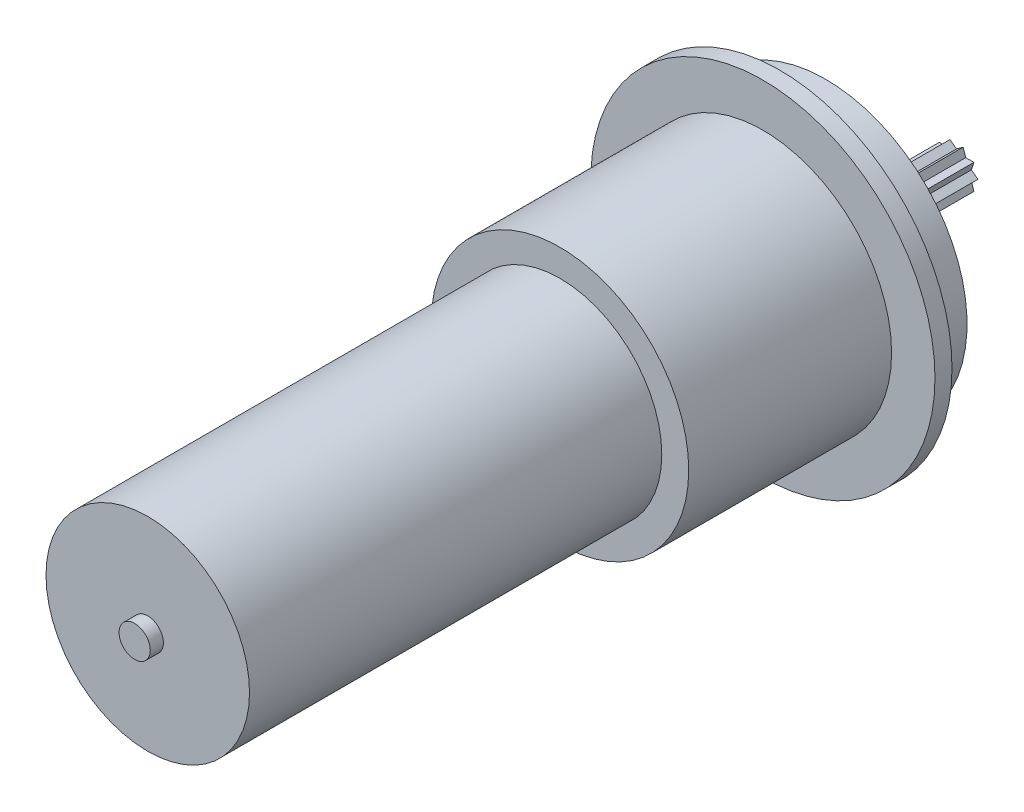
from build123d import *

# Parameters (mm, degrees)
SKETCH1_R           = 49.9618
BOSS_EXTRUDE1_DEPTH = 78.74
SKETCH2_R           = 66.802
BOSS_EXTRUDE2_DEPTH = 6.604
SKETCH3_R           = 54.864
BOSS_EXTRUDE3_DEPTH = 17.78
SKETCH4_R           = 11.878006526
BOSS_EXTRUDE4_DEPTH = 12.7
BOSS_EXTRUDE5_DEPTH = 38.1
SKETCH7_R           = 39.497
BOSS_EXTRUDE6_DEPTH = 160.02
SKETCH8_R           = 6.058651835
BOSS_EXTRUDE7_DEPTH = 5.08


with BuildPart() as part:
    # Sketch1 → Boss-Extrude1 (new body)
    with BuildSketch(Plane.XY):
        Circle(SKETCH1_R)
    extrude(amount=BOSS_EXTRUDE1_DEPTH)

    # Sketch2 → Boss-Extrude2 (add)
    with BuildSketch(Plane(origin=(0, 0, 0), x_dir=(-1, 0, 0), z_dir=(0, 0, -1))):
        with Locations(Location((0, 0, 0), (0, 0, 180))):
            Circle(SKETCH2_R)
    extrude(amount=BOSS_EXTRUDE2_DEPTH)

    # Sketch3 → Boss-Extrude3 (add)
    with BuildSketch(Plane(origin=(0, 0, -6.604), x_dir=(-1, 0, 0), z_dir=(0, 0, -1))):
        Circle(SKETCH3_R)
    extrude(amount=BOSS_EXTRUDE3_DEPTH)

    # Sketch4 → Boss-Extrude4 (add)
    with BuildSketch(Plane(origin=(0, 0, -24.384), x_dir=(-1, 0, 0), z_dir=(0, 0, -1))):
        Circle(SKETCH4_R)
    extrude(amount=BOSS_EXTRUDE4_DEPTH)

    # Sketch5 → Boss-Extrude5 (add)
    with BuildSketch(Plane(origin=(0, 0, -37.084), x_dir=(-1, 0, 0), z_dir=(0, 0, -1))):
        Polygon((8.315334724, 0), (5.74575498, 1.866908963), (6.727247106, 4.887631119), (3.551071869, 4.887631119), (2.569579744, 7.908353274), (0, 6.041444312), (-2.569579744, 7.908353274), (-3.551071869, 4.887631119), (-6.727247106, 4.887631119), (-5.74575498, 1.866908963), (-8.315334724, 0), (-5.74575498, -1.866908963), (-6.727247106, -4.887631119), (-3.551071869, -4.887631119), (-2.569579744, -7.908353274), (0, -6.041444312), (2.569579744, -7.908353274), (3.551071869, -4.887631119), (6.727247106, -4.887631119), (5.74575498, -1.866908963), align=None)
    extrude(amount=BOSS_EXTRUDE5_DEPTH)

    # Sketch7 → Boss-Extrude6 (add)
    with BuildSketch(Plane.XY.offset(78.74)):
        Circle(SKETCH7_R)
    extrude(amount=BOSS_EXTRUDE6_DEPTH)

    # Sketch8 → Boss-Extrude7 (add)
    with BuildSketch(Plane.XY.offset(238.76)):
        Circle(SKETCH8_R)
    extrude(amount=BOSS_EXTRUDE7_DEPTH)


solid = part.part
